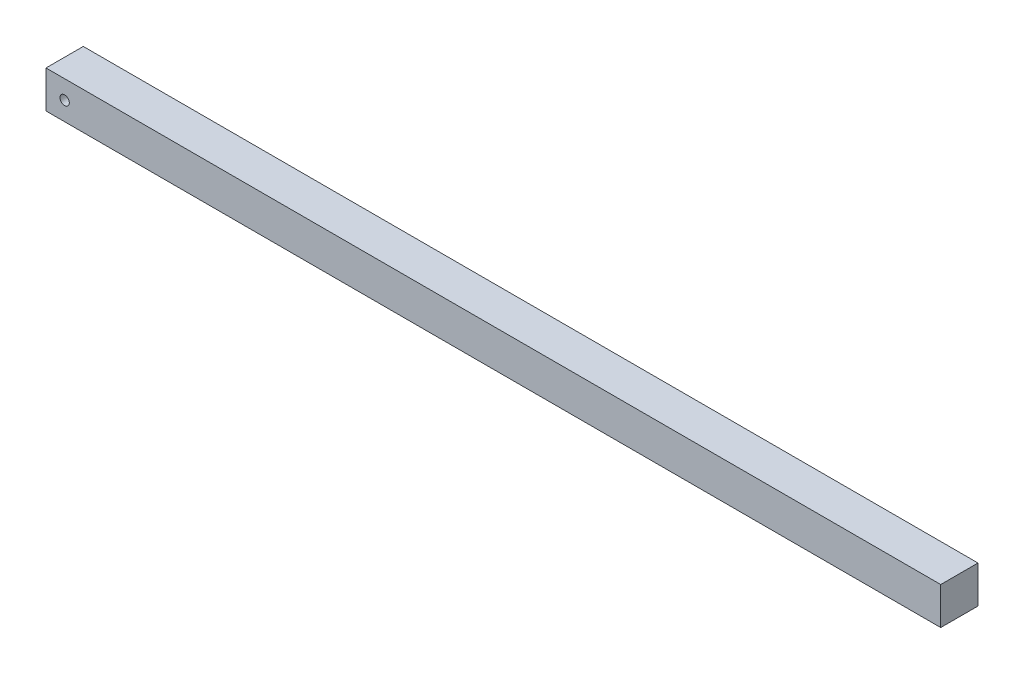
from build123d import *

# Parameters (mm, degrees)
SKETCH1_W           = 25.4
SKETCH1_H           = 25.4
BOSS_EXTRUDE1_DEPTH = 609.6
SKETCH5_R           = 3.175
CUT_EXTRUDE1_DEPTH  = 611.657416233


with BuildPart() as part:
    # Sketch1 → Boss-Extrude1 (new body)
    with BuildSketch(Plane(origin=(0, 0, 0), x_dir=(0, 0, -1), z_dir=(1, 0, 0))):
        with Locations((12.7, -12.7)):
            Rectangle(SKETCH1_W, SKETCH1_H)
    extrude(amount=BOSS_EXTRUDE1_DEPTH)

    # Sketch5 → Cut-Extrude1 (cut, through all)
    with BuildSketch(Plane.XY):
        with Locations((12.7, -12.7)):
            Circle(SKETCH5_R)
    extrude(amount=-CUT_EXTRUDE1_DEPTH, mode=Mode.SUBTRACT)


solid = part.part
